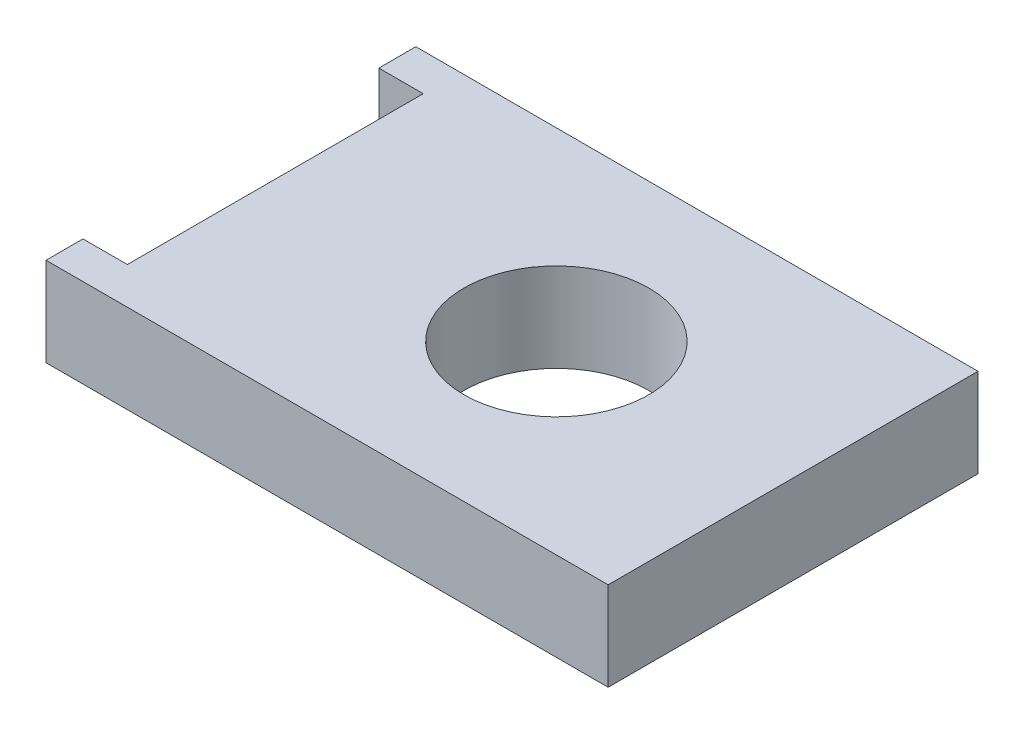
from build123d import *

# Parameters (mm, degrees)
SKETCH1_R           = 6.25
BOSS_EXTRUDE1_DEPTH = 3


with BuildPart() as part:
    # Sketch1 → Boss-Extrude1 (new, symmetric)
    with BuildSketch(Plane(origin=(0, 0, 0), x_dir=(1, 0, 0), z_dir=(0, 1, 0))):
        Polygon((-19, 10), (-16, 10), (-16, -10), (-19, -10), (-19, -12.5), (19, -12.5), (19, 12.5), (-19, 12.5), align=None)
        with Locations(Location((3, 0, 0), (0, 0, 270))):
            Circle(SKETCH1_R, mode=Mode.SUBTRACT)
    extrude(amount=BOSS_EXTRUDE1_DEPTH, both=True)


solid = part.part
